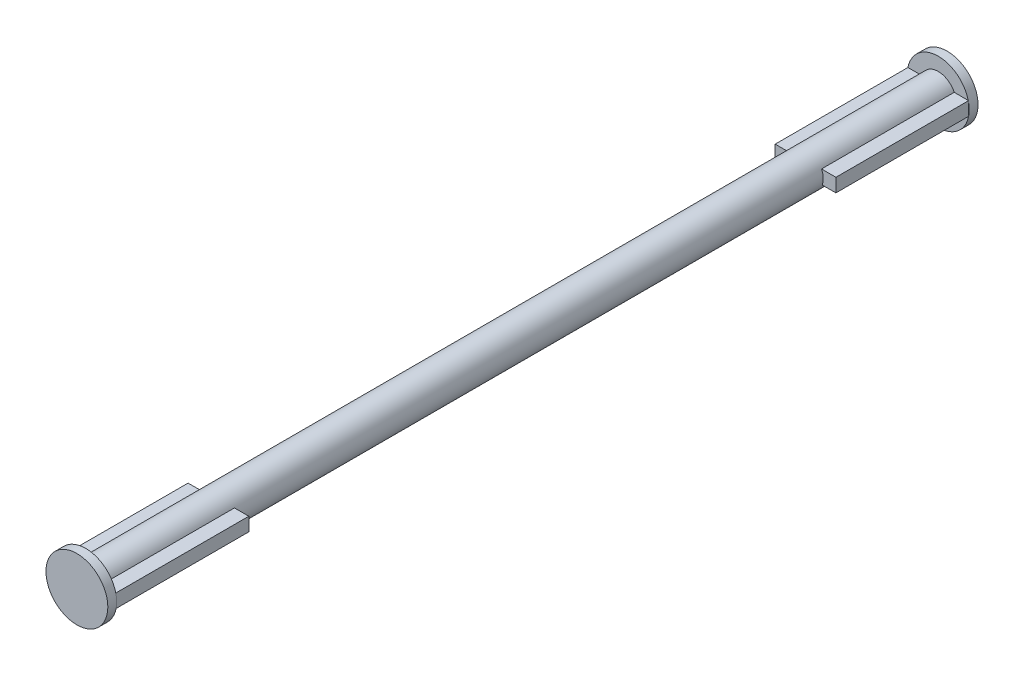
from build123d import *

# Parameters (mm, degrees)
SKETCH1_R           = 10
BOSS_EXTRUDE2_DEPTH = 481.8
BOSS_EXTRUDE4_DEPTH = 75
BOSS_EXTRUDE5_START = -75
BOSS_EXTRUDE5_DEPTH = 75
SKETCH7_R           = 17.483123284
BOSS_EXTRUDE6_DEPTH = 5
BOSS_EXTRUDE7_START = 5
SKETCH8_R           = 17.483123284
BOSS_EXTRUDE7_DEPTH = 5


with BuildPart() as part:
    # Sketch1 → Boss-Extrude2 (new body)
    with BuildSketch(Plane.XY):
        Circle(SKETCH1_R)
    extrude(amount=BOSS_EXTRUDE2_DEPTH)

    # Sketch2 → Boss-Extrude4 (add)
    with BuildSketch(Plane.XY):
        with BuildLine():
            Line((9.029963331, 4.296482543), (17.156826423, 4.296482543))
            Line((17.156826423, 4.296482543), (17.156826423, -3.361979608))
            Line((17.156826423, -3.361979608), (9.417913416, -3.361979608))
            ThreePointArc((9.417913416, -3.361979608), (9.987194288, 0.50591526), (9.029963331, 4.296482543))
        make_face()
        with BuildLine():
            Line((-9.029963331, -4.296482543), (-17.156826423, -4.296482543))
            Line((-17.156826423, -4.296482543), (-17.156826423, 3.361979608))
            Line((-17.156826423, 3.361979608), (-9.417913416, 3.361979608))
            ThreePointArc((-9.417913416, 3.361979608), (-9.987194288, -0.50591526), (-9.029963331, -4.296482543))
        make_face()
    extrude(amount=BOSS_EXTRUDE4_DEPTH)

    # Sketch4 → Boss-Extrude5 (add)
    with BuildSketch(Plane.XY.offset(481.8).offset(BOSS_EXTRUDE5_START)):
        with BuildLine():
            Line((9.029963331, 4.296482543), (17.156826423, 4.296482543))
            Line((17.156826423, 4.296482543), (17.156826423, -3.361979608))
            Line((17.156826423, -3.361979608), (9.417913416, -3.361979608))
            ThreePointArc((9.417913416, -3.361979608), (9.987194288, 0.50591526), (9.029963331, 4.296482543))
        make_face()
        with BuildLine():
            Line((-9.029963331, -4.296482543), (-17.156826423, -4.296482543))
            Line((-17.156826423, -4.296482543), (-17.156826423, 3.361979608))
            Line((-17.156826423, 3.361979608), (-9.417913416, 3.361979608))
            ThreePointArc((-9.417913416, 3.361979608), (-9.987194288, -0.50591526), (-9.029963331, -4.296482543))
        make_face()
    extrude(amount=BOSS_EXTRUDE5_DEPTH)

    # Sketch7 → Boss-Extrude6 (add)
    with BuildSketch(Plane.XY.offset(481.8)):
        with Locations(Location((0, 0, 0), (0, 0, 168.913043394))):
            Circle(SKETCH7_R)
    extrude(amount=BOSS_EXTRUDE6_DEPTH)

    # Sketch8 → Boss-Extrude7 (add)
    with BuildSketch(Plane(origin=(0, 0, 0), x_dir=(-1, 0, 0), z_dir=(0, 0, -1)).offset(BOSS_EXTRUDE7_START)):
        with Locations(Location((0, 0, 0), (0, 0, 11.086956606))):
            Circle(SKETCH8_R)
    extrude(amount=-BOSS_EXTRUDE7_DEPTH)


solid = part.part
